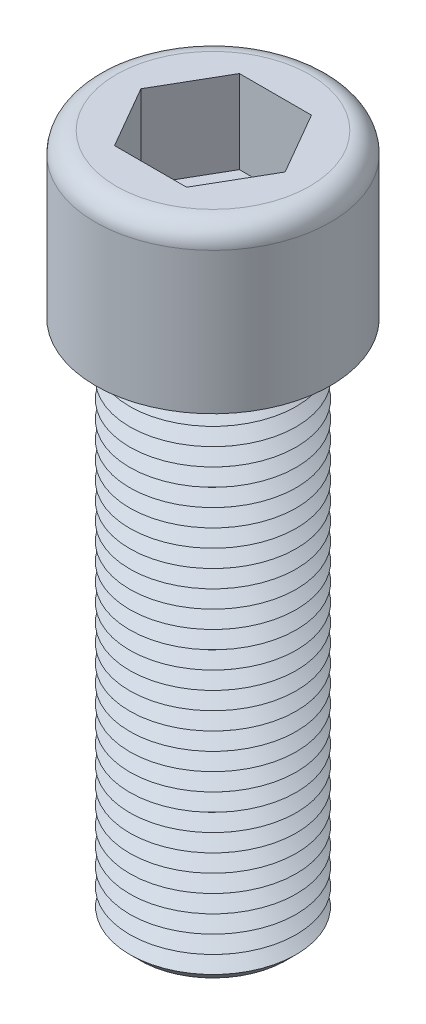
from build123d import *

# Parameters (mm, degrees)
CUT_EXTRUDE_1_DEPTH = 4


with BuildPart() as part:
    # 草图1 → 旋转1 (revolve)
    with BuildSketch(Plane.XY, mode=Mode.PRIVATE) as revolve_1_sk:
        with BuildLine():
            Line((0, 0), (0, 32.8))
            Line((0, 32.8), (4.65, 32.8))
            ThreePointArc((4.65, 32.8), (5.357106781, 32.507106781), (5.65, 31.8))
            Line((5.65, 31.8), (5.65, 25))
            Line((5.65, 25), (4, 25))
            Line((4, 25), (3.4, 24.577341211))
            Line((3.4, 24.577341211), (4, 24.154682421))
            Line((4, 24.154682421), (3.4, 23.732023632))
            Line((3.4, 23.732023632), (4, 23.309364843))
            Line((4, 23.309364843), (3.4, 22.886706054))
            Line((3.4, 22.886706054), (4, 22.464047264))
            Line((4, 22.464047264), (3.4, 22.041388475))
            Line((3.4, 22.041388475), (4, 21.618729686))
            Line((4, 21.618729686), (3.4, 21.196070897))
            Line((3.4, 21.196070897), (4, 20.773412107))
            Line((4, 20.773412107), (3.4, 20.350753318))
            Line((3.4, 20.350753318), (4, 19.928094529))
            Line((4, 19.928094529), (3.4, 19.50543574))
            Line((3.4, 19.50543574), (4, 19.08277695))
            Line((4, 19.08277695), (3.4, 18.660118161))
            Line((3.4, 18.660118161), (4, 18.237459372))
            Line((4, 18.237459372), (3.4, 17.814800583))
            Line((3.4, 17.814800583), (4, 17.392141793))
            Line((4, 17.392141793), (3.4, 16.969483004))
            Line((3.4, 16.969483004), (4, 16.546824215))
            Line((4, 16.546824215), (3.4, 16.124165426))
            Line((3.4, 16.124165426), (4, 15.701506636))
            Line((4, 15.701506636), (3.4, 15.278847847))
            Line((3.4, 15.278847847), (4, 14.856189058))
            Line((4, 14.856189058), (3.4, 14.433530269))
            Line((3.4, 14.433530269), (4, 14.010871479))
            Line((4, 14.010871479), (3.4, 13.58821269))
            Line((3.4, 13.58821269), (4, 13.165553901))
            Line((4, 13.165553901), (3.4, 12.742895112))
            Line((3.4, 12.742895112), (4, 12.320236322))
            Line((4, 12.320236322), (3.4, 11.897577533))
            Line((3.4, 11.897577533), (4, 11.474918744))
            Line((4, 11.474918744), (3.4, 11.052259955))
            Line((3.4, 11.052259955), (4, 10.629601165))
            Line((4, 10.629601165), (3.4, 10.206942376))
            Line((3.4, 10.206942376), (4, 9.784283587))
            Line((4, 9.784283587), (3.4, 9.361624798))
            Line((3.4, 9.361624798), (4, 8.938966008))
            Line((4, 8.938966008), (3.4, 8.516307219))
            Line((3.4, 8.516307219), (4, 8.09364843))
            Line((4, 8.09364843), (3.4, 7.67098964))
            Line((3.4, 7.67098964), (4, 7.248330851))
            Line((4, 7.248330851), (3.4, 6.825672062))
            Line((3.4, 6.825672062), (4, 6.403013273))
            Line((4, 6.403013273), (3.4, 5.980354483))
            Line((3.4, 5.980354483), (4, 5.557695694))
            Line((4, 5.557695694), (3.4, 5.135036905))
            Line((3.4, 5.135036905), (4, 4.712378116))
            Line((4, 4.712378116), (3.4, 4.289719326))
            Line((3.4, 4.289719326), (4, 3.867060537))
            Line((4, 3.867060537), (3.4, 3.444401748))
            Line((3.4, 3.444401748), (4, 3.021742959))
            Line((4, 3.021742959), (3.4, 2.599084169))
            Line((3.4, 2.599084169), (4, 2.17642538))
            Line((4, 2.17642538), (3.4, 1.753766591))
            Line((3.4, 1.753766591), (4, 1.331107802))
            Line((4, 1.331107802), (3.4, 0.908449012))
            Line((3.4, 0.908449012), (3.991663039, 0.491663039))
            Line((3.991663039, 0.491663039), (3.5, 0))
            Line((3.5, 0), (0, 0))
        make_face()
    revolve(revolve_1_sk.sketch.rotate(Axis((0, 31.8, 0), (0, 1, 0)), 90), axis=Axis((0, 31.8, 0), (0, 1, 0)))

    # 草图3 → 切除-拉伸1 (cut)
    with BuildSketch(Plane(origin=(0, 32.8, 0), x_dir=(1, 0, 0), z_dir=(0, 1, 0))):
        Polygon((3.464101615, 0), (1.732050808, 3), (-1.732050808, 3), (-3.464101615, 0), (-1.732050808, -3), (1.732050808, -3), align=None)
    extrude(amount=-CUT_EXTRUDE_1_DEPTH, mode=Mode.SUBTRACT)


solid = part.part
